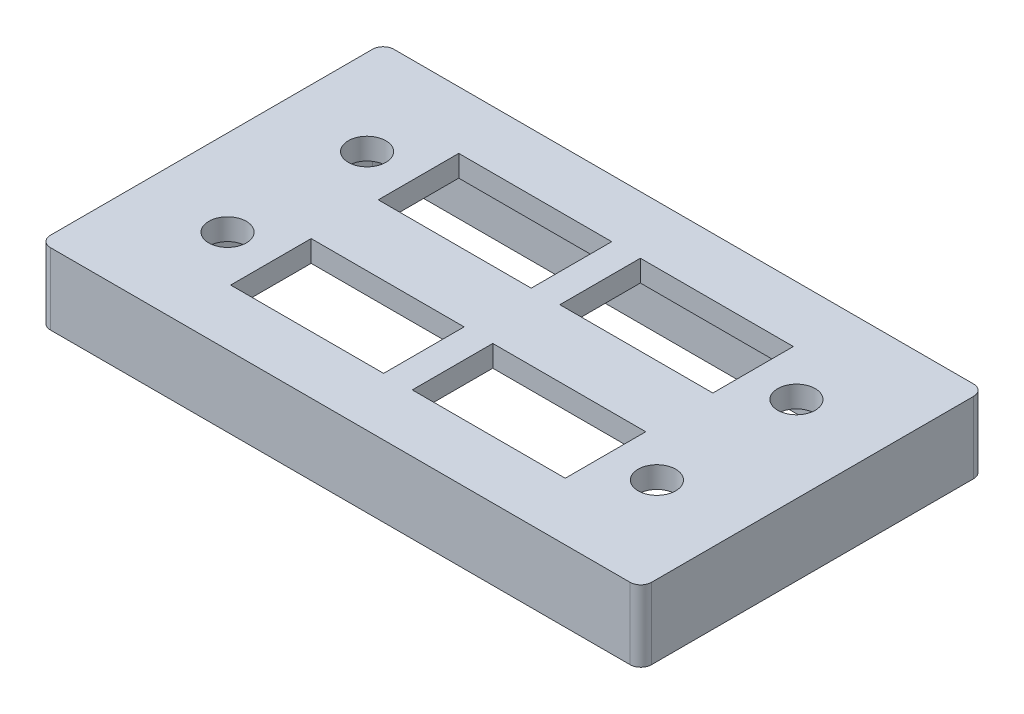
from build123d import *

# Parameters (mm, degrees)
SKETCH1_W               = 56
SKETCH1_H               = 32
BOSS_EXTRUDE1_DEPTH     = 2
SKETCH2_R               = 1.75
CUT_EXTRUDE1_DEPTH      = 33.310988843
MIRROR2_COPY_1_SKETCH_R = 1.75
MIRROR2_COPY_1_DEPTH    = 33.310988843
SKETCH4_W               = 14.25
SKETCH4_H               = 7.5
CUT_EXTRUDE2_DEPTH      = 33.310988843
MIRROR4_COPY_1_SKETCH_W = 14.25
MIRROR4_COPY_1_SKETCH_H = 7.5
MIRROR4_COPY_1_DEPTH    = 33.310988843
SKETCH5_W               = 56
SKETCH5_H               = 32
SKETCH5_W_2             = 50
SKETCH5_H_2             = 26
BOSS_EXTRUDE2_DEPTH     = 4.65
SKETCH6_W               = 51
SKETCH6_H               = 27
SKETCH6_W_2             = 50
SKETCH6_H_2             = 26
BOSS_EXTRUDE3_DEPTH     = 1
FILLET1_R               = 1


with BuildPart() as part:
    # Sketch1 → Boss-Extrude1 (new body)
    with BuildSketch(Plane(origin=(0, 0, 0), x_dir=(1, 0, 0), z_dir=(0, 1, 0))):
        Rectangle(SKETCH1_W, SKETCH1_H)
    extrude(amount=BOSS_EXTRUDE1_DEPTH)

    # Sketch2 → Cut-Extrude1 (cut, through all)
    with BuildSketch(Plane(origin=(0, 0, 0), x_dir=(1, 0, 0), z_dir=(0, 1, 0))):
        with Locations(Location((20, 6.5, 0), (0, 0, 270))):
            Circle(SKETCH2_R)
    cut_extrude1 = extrude(amount=CUT_EXTRUDE1_DEPTH, mode=Mode.SUBTRACT)

    # Mirror1: Cut-Extrude1 across plane
    add(cut_extrude1.mirror(Plane.XY), mode=Mode.SUBTRACT)

    # Mirror2: Cut-Extrude1 across plane
    add(cut_extrude1.mirror(Plane(origin=(0, 0, 0), x_dir=(0, 0, 1), z_dir=(1, 0, 0))), mode=Mode.SUBTRACT)

    # Mirror2 copy 1 sketch → Mirror2 copy 1 (cut, through all)
    with BuildSketch(Plane(origin=(0, 0, 0), x_dir=(-1, 0, 0), z_dir=(0, 1, 0))):
        with Locations(Location((20, 6.5, 0), (0, 0, 270))):
            Circle(MIRROR2_COPY_1_SKETCH_R)
    extrude(amount=MIRROR2_COPY_1_DEPTH, mode=Mode.SUBTRACT)

    # Sketch4 → Cut-Extrude2 (cut, through all)
    with BuildSketch(Plane(origin=(0, 0, 0), x_dir=(1, 0, 0), z_dir=(0, 1, 0))):
        with Locations((8.46, 6.875)):
            Rectangle(SKETCH4_W, SKETCH4_H)
    cut_extrude2 = extrude(amount=CUT_EXTRUDE2_DEPTH, mode=Mode.SUBTRACT)

    # Mirror3: Cut-Extrude2 across plane
    add(cut_extrude2.mirror(Plane(origin=(0, 0, 0), x_dir=(0, 0, 1), z_dir=(1, 0, 0))), mode=Mode.SUBTRACT)

    # Mirror4: Cut-Extrude2 across plane
    add(cut_extrude2.mirror(Plane.XY), mode=Mode.SUBTRACT)

    # Mirror4 copy 1 sketch → Mirror4 copy 1 (cut, through all)
    with BuildSketch(Plane(origin=(0, 0, 0), x_dir=(-1, 0, 0), z_dir=(0, 1, 0))):
        with Locations((8.46, 6.875)):
            Rectangle(MIRROR4_COPY_1_SKETCH_W, MIRROR4_COPY_1_SKETCH_H)
    extrude(amount=MIRROR4_COPY_1_DEPTH, mode=Mode.SUBTRACT)

    # Sketch5 → Boss-Extrude2 (add)
    with BuildSketch(Plane.XZ):
        Rectangle(SKETCH5_W, SKETCH5_H)
        Rectangle(SKETCH5_W_2, SKETCH5_H_2, mode=Mode.SUBTRACT)
    extrude(amount=BOSS_EXTRUDE2_DEPTH)

    # Sketch6 → Boss-Extrude3 (add)
    with BuildSketch(Plane.XZ.offset(4.65)):
        Rectangle(SKETCH6_W, SKETCH6_H)
        Rectangle(SKETCH6_W_2, SKETCH6_H_2, mode=Mode.SUBTRACT)
    extrude(amount=BOSS_EXTRUDE3_DEPTH)

    # Fillet1
    fillet1_edges = [part.edges().sort_by_distance(p)[0] for p in [
        (-25.5, -5.15, -13.5),
        (25.5, -5.15, -13.5),
        (25.5, -5.15, 13.5),
        (-25.5, -5.15, 13.5),
        (28, -1.325, 16),
        (-28, -1.325, 16),
        (-28, -1.325, -16),
        (28, -1.325, -16),
        (25, -2.825, -13),
        (25, -2.825, 13),
        (-25, -2.825, 13),
        (-25, -2.825, -13),
    ]]
    fillet(fillet1_edges, radius=FILLET1_R)


solid = part.part
